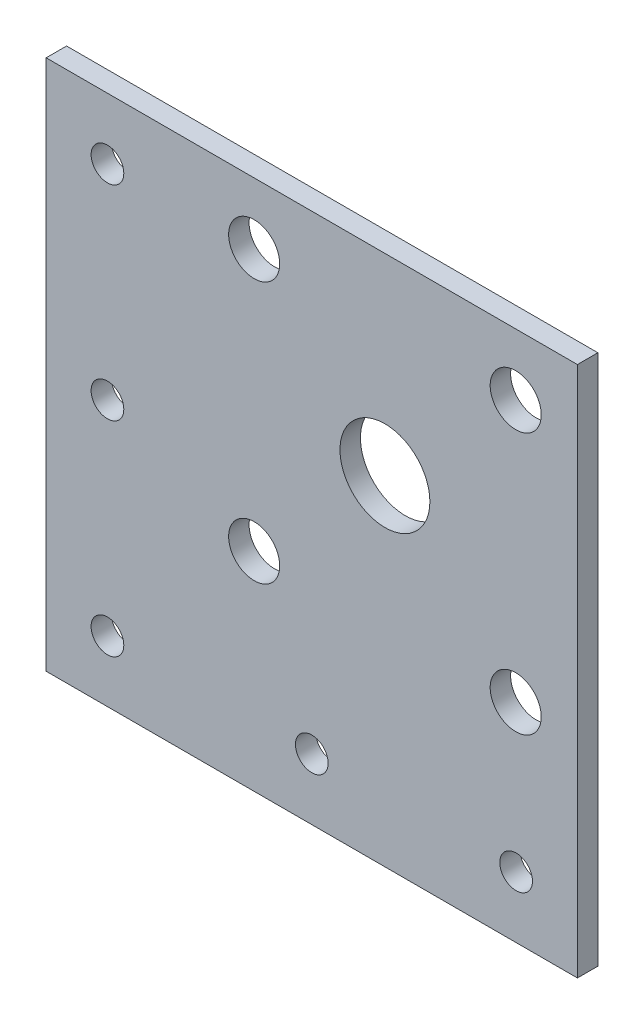
from build123d import *

# Parameters (mm, degrees)
SKETCH_1_W      = 130
SKETCH_1_H      = 130
SKETCH_1_R      = 6.25
SKETCH_1_R_2    = 4
SKETCH_1_R_3    = 11
EXTRUDE_1_DEPTH = 5


with BuildPart() as part:
    # 草图1 → 凸台-拉伸1 (new body)
    with BuildSketch(Plane.XY):
        with Locations((-17.9, -17.9)):
            Rectangle(SKETCH_1_W, SKETCH_1_H)
        with Locations((-32, -32)):
            Circle(SKETCH_1_R, mode=Mode.SUBTRACT)
        with Locations((-32, 32)):
            Circle(SKETCH_1_R, mode=Mode.SUBTRACT)
        with Locations((32, 32)):
            Circle(SKETCH_1_R, mode=Mode.SUBTRACT)
        with Locations((32, -32)):
            Circle(SKETCH_1_R, mode=Mode.SUBTRACT)
        with Locations((-67.9, 32.1)):
            Circle(SKETCH_1_R_2, mode=Mode.SUBTRACT)
        with Locations((-67.9, -17.9)):
            Circle(SKETCH_1_R_2, mode=Mode.SUBTRACT)
        with Locations((-67.9, -67.9)):
            Circle(SKETCH_1_R_2, mode=Mode.SUBTRACT)
        with Locations((-17.9, -67.9)):
            Circle(SKETCH_1_R_2, mode=Mode.SUBTRACT)
        with Locations((32.1, -67.9)):
            Circle(SKETCH_1_R_2, mode=Mode.SUBTRACT)
        Circle(SKETCH_1_R_3, mode=Mode.SUBTRACT)
    extrude(amount=EXTRUDE_1_DEPTH)


solid = part.part
